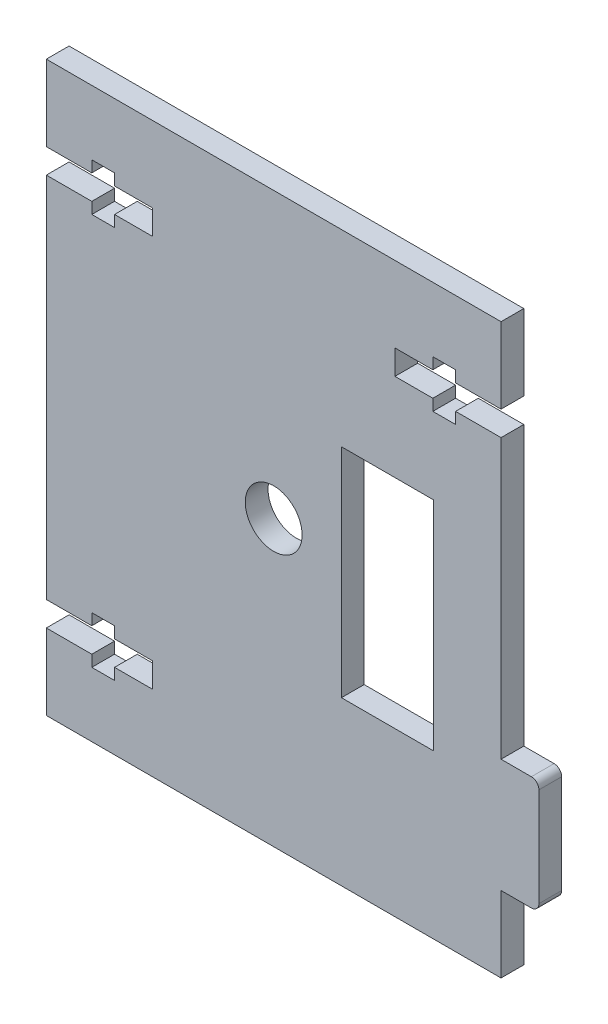
from build123d import *

# Parameters (mm, degrees)
ESQUISSE1_R        = 3.75
ESQUISSE1_W        = 12.12
ESQUISSE1_H        = 28.68
BOSS_EXTRU_1_DEPTH = 3
CONG_3_R           = 1


with BuildPart() as part:
    # Esquisse1 → Boss.-Extru.1 (new body)
    with BuildSketch(Plane.XY):
        Polygon((-30, 37.5), (30, 37.5), (30, 27.5), (24, 27.5), (24, 29), (21, 29), (21, 27.5), (16, 27.5), (16, 24.25), (21, 24.25), (21, 22.75), (24, 22.75), (24, 24.25), (30, 24.25), (30, 12.5), (30, -12.5), (35, -12.5), (35, -27.5), (30, -27.5), (30, -37.5), (-30, -37.5), (-30, -27.5), (-24, -27.5), (-24, -29), (-21, -29), (-21, -27.5), (-16, -27.5), (-16, -24.25), (-21, -24.25), (-21, -22.75), (-24, -22.75), (-24, -24.25), (-30, -24.25), (-30, -12.5), (-30, 12.5), (-30, 24.25), (-24, 24.25), (-24, 22.75), (-21, 22.75), (-21, 24.25), (-16, 24.25), (-16, 27.5), (-21, 27.5), (-21, 29), (-24, 29), (-24, 27.5), (-30, 27.5), align=None)
        Circle(ESQUISSE1_R, mode=Mode.SUBTRACT)
        with Locations((15, -1.66)):
            Rectangle(ESQUISSE1_W, ESQUISSE1_H, mode=Mode.SUBTRACT)
    extrude(amount=BOSS_EXTRU_1_DEPTH)

    # Congé3
    cong_3_edges = [part.edges().sort_by_distance(p)[0] for p in [
        (35, -12.5, 1.5),
        (35, -27.5, 1.5),
    ]]
    fillet(cong_3_edges, radius=CONG_3_R)


solid = part.part
